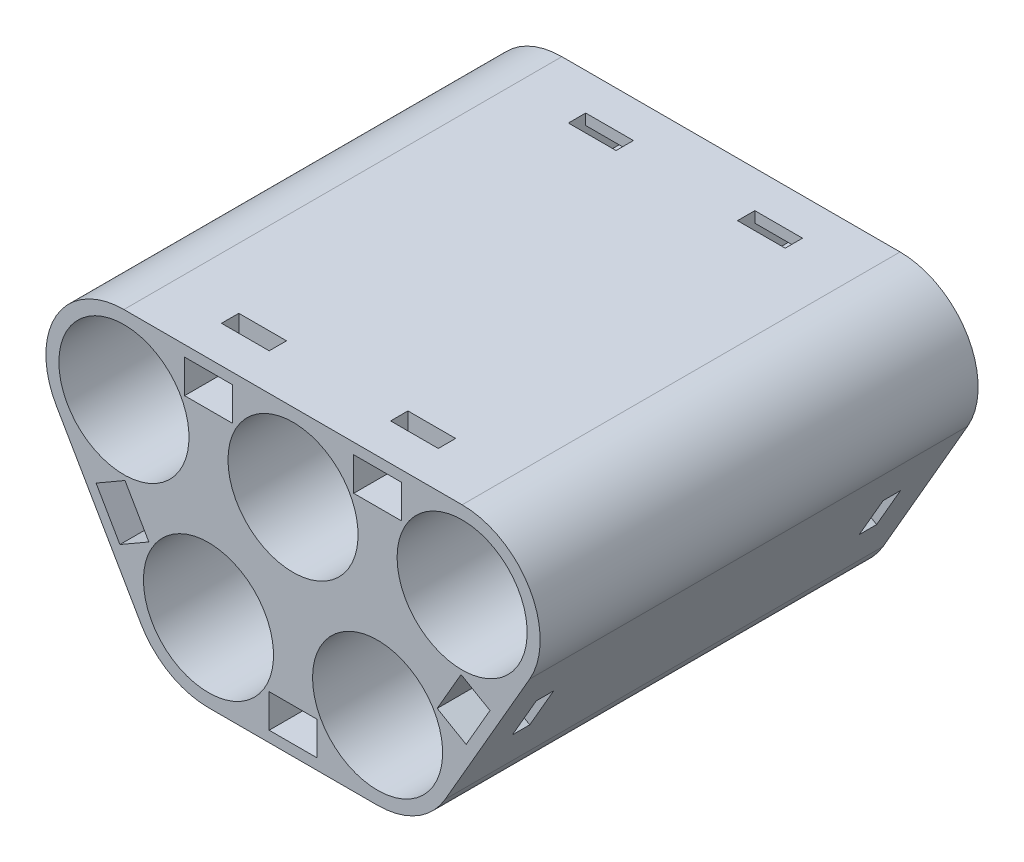
from build123d import *

# Parameters (mm, degrees)
SKETCH1_R               = 7.5
BOSS_EXTRUDE1_DEPTH     = 50.5
SKETCH2_W               = 2
SKETCH2_H               = 5.5
CUT_EXTRUDE1_DEPTH      = 1.5
SKETCH3_W               = 5.5
SKETCH3_H               = 2
CUT_EXTRUDE2_DEPTH      = 1.5
SKETCH4_W               = 5.5
SKETCH4_H               = 2
CUT_EXTRUDE3_DEPTH      = 1.5
SKETCH5_W               = 5.5
SKETCH5_H               = 3.854101966
CUT_EXTRUDE4_DEPTH      = 6.25
MIRROR3_COPY_1_SKETCH_W = 2
MIRROR3_COPY_1_SKETCH_H = 5.5
MIRROR3_COPY_1_DEPTH    = 1.5
MIRROR3_COPY_2_SKETCH_W = 5.5
MIRROR3_COPY_2_SKETCH_H = 2
MIRROR3_COPY_2_DEPTH    = 1.5
MIRROR3_COPY_3_SKETCH_W = 5.5
MIRROR3_COPY_3_SKETCH_H = 2
MIRROR3_COPY_3_DEPTH    = 1.5
MIRROR3_COPY_4_SKETCH_W = 5.5
MIRROR3_COPY_4_SKETCH_H = 3.854101966
MIRROR3_COPY_4_DEPTH    = 6.25


with BuildPart() as part:
    # Sketch1 → Boss-Extrude1 (new body)
    with BuildSketch(Plane.XY):
        with BuildLine():
            Line((0, 9), (39, 9))
            ThreePointArc((39, 9), (46.794228634, 4.5), (46.794228634, -4.5))
            Line((46.794228634, -4.5), (37.044228634, -21.387495374))
            ThreePointArc((37.044228634, -21.387495374), (33.75, -24.681724008), (29.25, -25.887495374))
            Line((29.25, -25.887495374), (9.75, -25.887495374))
            ThreePointArc((9.75, -25.887495374), (5.25, -24.681724008), (1.955771366, -21.387495374))
            Line((1.955771366, -21.387495374), (-7.794228634, -4.5))
            ThreePointArc((-7.794228634, -4.5), (-7.794228634, 4.5), (0, 9))
        make_face()
        with Locations(Location((0, 0, 0), (0, 0, 180))):
            Circle(SKETCH1_R, mode=Mode.SUBTRACT)
        with Locations(Location((9.75, -16.887495374, 0), (0, 0, 180))):
            Circle(SKETCH1_R, mode=Mode.SUBTRACT)
        with Locations(Location((19.5, 0, 0), (0, 0, 180))):
            Circle(SKETCH1_R, mode=Mode.SUBTRACT)
        with Locations(Location((39, 0, 0), (0, 0, 180))):
            Circle(SKETCH1_R, mode=Mode.SUBTRACT)
        with Locations(Location((29.25, -16.887495374, 0), (0, 0, 180))):
            Circle(SKETCH1_R, mode=Mode.SUBTRACT)
    extrude(amount=BOSS_EXTRUDE1_DEPTH)

    # Sketch2 → Cut-Extrude1 (cut)
    with BuildSketch(Plane(origin=(37.044228634, -21.387495374, 0), x_dir=(0, 0, -1), z_dir=(0.8660254037844384, -0.5000000000000007, 0))):
        with Locations((-5.25, 9.75)):
            Rectangle(SKETCH2_W, SKETCH2_H)
    cut_extrude1 = extrude(amount=-CUT_EXTRUDE1_DEPTH, mode=Mode.SUBTRACT)

    # Sketch3 → Cut-Extrude2 (cut)
    with BuildSketch(Plane(origin=(0, 9, 0), x_dir=(1, 0, 0), z_dir=(0, 1, 0))):
        with Locations((29.25, -5.25)):
            Rectangle(SKETCH3_W, SKETCH3_H)
    cut_extrude2 = extrude(amount=-CUT_EXTRUDE2_DEPTH, mode=Mode.SUBTRACT)

    # Sketch4 → Cut-Extrude3 (cut)
    with BuildSketch(Plane.XZ.offset(25.887495374)):
        with Locations((19.5, 5.25)):
            Rectangle(SKETCH4_W, SKETCH4_H)
    cut_extrude3 = extrude(amount=-CUT_EXTRUDE3_DEPTH, mode=Mode.SUBTRACT)

    # Sketch5 → Cut-Extrude4 (cut)
    with BuildSketch(Plane(origin=(0, 0, 0), x_dir=(-1, 0, 0), z_dir=(0, 0, -1))):
        with Locations((-29.25, 5.822949017)):
            Rectangle(SKETCH5_W, SKETCH5_H)
        with Locations((-19.5, -22.710444391)):
            Rectangle(SKETCH5_W, SKETCH5_H)
        Polygon((-38.873946668, -8.010126843), (-36.123946668, -12.773266564), (-39.461696879, -14.700317547), (-42.211696879, -9.937177826), align=None)
    cut_extrude4 = extrude(amount=-CUT_EXTRUDE4_DEPTH, mode=Mode.SUBTRACT)

    # Mirror2: Cut-Extrude1, Cut-Extrude2, Cut-Extrude3, Cut-Extrude4 across plane
    add(cut_extrude1.mirror(Plane.ZY.offset(-19.5)), mode=Mode.SUBTRACT)
    add(cut_extrude2.mirror(Plane.ZY.offset(-19.5)), mode=Mode.SUBTRACT)
    add(cut_extrude3.mirror(Plane.ZY.offset(-19.5)), mode=Mode.SUBTRACT)
    add(cut_extrude4.mirror(Plane.ZY.offset(-19.5)), mode=Mode.SUBTRACT)

    # Mirror3: Cut-Extrude1, Cut-Extrude2, Cut-Extrude3, Cut-Extrude4 across plane
    add(cut_extrude1.mirror(Plane(origin=(0, 0, 25.25), x_dir=(1, 0, 0), z_dir=(0, 0, -1))), mode=Mode.SUBTRACT)
    add(cut_extrude2.mirror(Plane(origin=(0, 0, 25.25), x_dir=(1, 0, 0), z_dir=(0, 0, -1))), mode=Mode.SUBTRACT)
    add(cut_extrude3.mirror(Plane(origin=(0, 0, 25.25), x_dir=(1, 0, 0), z_dir=(0, 0, -1))), mode=Mode.SUBTRACT)
    add(cut_extrude4.mirror(Plane(origin=(0, 0, 25.25), x_dir=(1, 0, 0), z_dir=(0, 0, -1))), mode=Mode.SUBTRACT)

    # Mirror3 copy 1 sketch → Mirror3 copy 1 (cut)
    with BuildSketch(Plane(origin=(1.955771366, -21.387495374, 50.5), x_dir=(0, 0, 1), z_dir=(-0.8660254037844384, -0.5000000000000007, 1.2779807689605148e-15))):
        with Locations((-5.25, 9.75)):
            Rectangle(MIRROR3_COPY_1_SKETCH_W, MIRROR3_COPY_1_SKETCH_H)
    extrude(amount=-MIRROR3_COPY_1_DEPTH, mode=Mode.SUBTRACT)

    # Mirror3 copy 2 sketch → Mirror3 copy 2 (cut)
    with BuildSketch(Plane(origin=(39, 9, 50.5), x_dir=(-1, 0, 0), z_dir=(0, 1, 0))):
        with Locations((29.25, -5.25)):
            Rectangle(MIRROR3_COPY_2_SKETCH_W, MIRROR3_COPY_2_SKETCH_H)
    extrude(amount=-MIRROR3_COPY_2_DEPTH, mode=Mode.SUBTRACT)

    # Mirror3 copy 3 sketch → Mirror3 copy 3 (cut)
    with BuildSketch(Plane(origin=(39, -25.887495374, 50.5), x_dir=(-1, 0, 0), z_dir=(0, -1, 0))):
        with Locations((19.5, 5.25)):
            Rectangle(MIRROR3_COPY_3_SKETCH_W, MIRROR3_COPY_3_SKETCH_H)
    extrude(amount=-MIRROR3_COPY_3_DEPTH, mode=Mode.SUBTRACT)

    # Mirror3 copy 4 sketch → Mirror3 copy 4 (cut)
    with BuildSketch(Plane(origin=(39, 0, 50.5), x_dir=(1, 0, 0), z_dir=(0, 0, 1))):
        with Locations((-29.25, 5.822949017)):
            Rectangle(MIRROR3_COPY_4_SKETCH_W, MIRROR3_COPY_4_SKETCH_H)
        with Locations((-19.5, -22.710444391)):
            Rectangle(MIRROR3_COPY_4_SKETCH_W, MIRROR3_COPY_4_SKETCH_H)
        Polygon((-38.873946668, -8.010126843), (-36.123946668, -12.773266564), (-39.461696879, -14.700317547), (-42.211696879, -9.937177826), align=None)
    extrude(amount=-MIRROR3_COPY_4_DEPTH, mode=Mode.SUBTRACT)


solid = part.part
